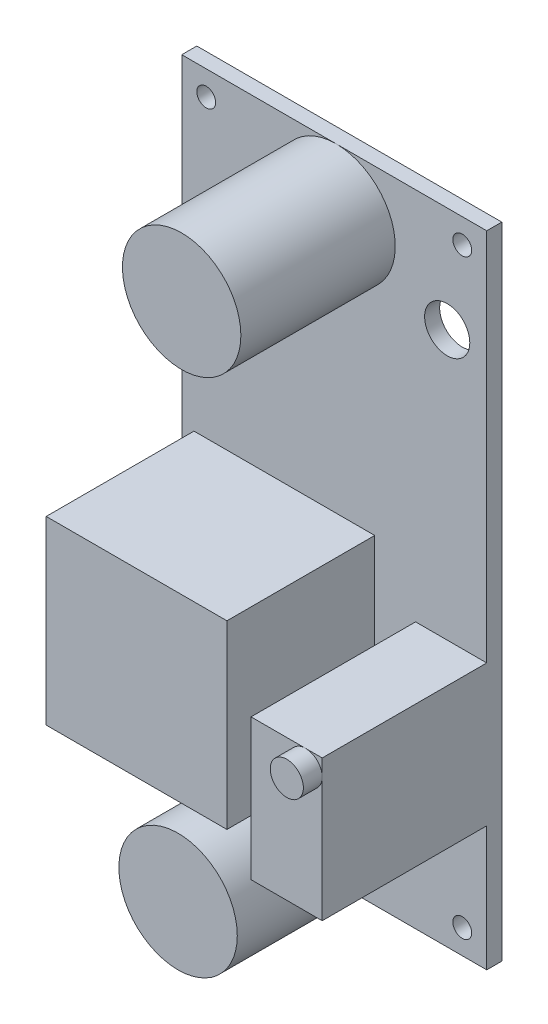
from build123d import *

# Parameters (mm, degrees)
SKETCH1_W           = 20.574
SKETCH1_H           = 43.18
BOSS_EXTRUDE1_DEPTH = 1.016
SKETCH2_R           = 1.524
CUT_EXTRUDE1_DEPTH  = 48.841761381
SKETCH3_R           = 0.635
CUT_EXTRUDE2_DEPTH  = 2.54
SKETCH4_W           = 0.79375
SKETCH4_H           = 0.071233975
SKETCH4_W_2         = 0.081410257
SKETCH4_H_2         = 0.305288462
SKETCH4_H_3         = 0.071233974
BOSS_EXTRUDE2_DEPTH = 0.00254
SKETCH5_W           = 12.192
SKETCH5_H           = 12.192
BOSS_EXTRUDE3_DEPTH = 9.9695
SKETCH6_R           = 3.99415
BOSS_EXTRUDE4_DEPTH = 10.414
SKETCH7_W           = 4.8006
SKETCH7_H           = 9.5123
BOSS_EXTRUDE5_DEPTH = 11.0998
SKETCH8_R           = 1.1176
BOSS_EXTRUDE6_DEPTH = 1.27


with BuildPart() as part:
    # Sketch1 → Boss-Extrude1 (new body)
    with BuildSketch(Plane.XY):
        with Locations((10.287, 21.59)):
            Rectangle(SKETCH1_W, SKETCH1_H)
    extrude(amount=BOSS_EXTRUDE1_DEPTH)

    # Sketch2 → Cut-Extrude1 (cut, through all)
    with BuildSketch(Plane.XY.offset(1.016)):
        with Locations((17.907, 36.068)):
            Circle(SKETCH2_R)
        with Locations((3.0988, 6.35)):
            Circle(SKETCH2_R)
    extrude(amount=-CUT_EXTRUDE1_DEPTH, mode=Mode.SUBTRACT)

    # Sketch3 → Cut-Extrude2 (cut)
    with BuildSketch(Plane.XY.offset(1.016)):
        with Locations((18.923, 41.529)):
            Circle(SKETCH3_R)
        with Locations((18.923, 1.651)):
            Circle(SKETCH3_R)
        with Locations((1.651, 1.651)):
            Circle(SKETCH3_R)
        with Locations((1.651, 41.529)):
            Circle(SKETCH3_R)
    extrude(amount=-CUT_EXTRUDE2_DEPTH, mode=Mode.SUBTRACT)

    # Sketch4 → Boss-Extrude2 (add)
    # profile 1 of 14: a face of its own
    with BuildSketch(Plane(origin=(0, 0, 0), x_dir=(-1, 0, 0), z_dir=(0, 0, -1))):
        Polygon((-17.848673525, 42.286725962), (-18.082728012, 42.286725962), (-18.082728012, 42.357959936), (-17.848673525, 42.357959936), (-17.848673525, 42.592014423), (-17.777439551, 42.592014423), (-17.777439551, 42.357959936), (-17.543385063, 42.357959936), (-17.543385063, 42.286725962), (-17.777439551, 42.286725962), (-17.777439551, 42.052671474), (-17.848673525, 42.052671474), align=None)
    # profile 2 of 14: a face of its own
    with BuildSketch(Plane(origin=(0, 0, 0), x_dir=(-1, 0, 0), z_dir=(0, 0, -1))):
        Polygon((-17.421269679, 41.279274038), (-18.215019679, 41.279274038), (-18.215019679, 41.294220453), (-17.590291363, 41.818616987), (-18.215019679, 41.818616987), (-18.215019679, 41.889850962), (-17.421269679, 41.889850962), (-17.421269679, 41.873632512), (-18.044566954, 41.350508013), (-17.421269679, 41.350508013), align=None)
    # profile 3 of 14: a face of its own
    with BuildSketch(Plane(origin=(0, 0, 0), x_dir=(-1, 0, 0), z_dir=(0, 0, -1))):
        with Locations((-17.818144679, 41.070660257)):
            Rectangle(SKETCH4_W, SKETCH4_H)
    # profile 4 of 14: a face of its own
    with BuildSketch(Plane(origin=(0, 0, 0), x_dir=(-1, 0, 0), z_dir=(0, 0, -1))):
        with Locations((-2.746900665, 42.32743109)):
            Rectangle(SKETCH4_W_2, SKETCH4_H_2)
    # profile 5 of 14: a face of its own
    with BuildSketch(Plane(origin=(0, 0, 0), x_dir=(-1, 0, 0), z_dir=(0, 0, -1))):
        Polygon((-2.441612203, 41.431918269), (-3.235362203, 41.431918269), (-3.235362203, 41.446864683), (-2.610633888, 41.971261218), (-3.235362203, 41.971261218), (-3.235362203, 42.042495192), (-2.441612203, 42.042495192), (-2.441612203, 42.026276743), (-3.064909479, 41.503152244), (-2.441612203, 41.503152244), align=None)
    # profile 6 of 14: a face of its own
    with BuildSketch(Plane(origin=(0, 0, 0), x_dir=(-1, 0, 0), z_dir=(0, 0, -1))):
        with Locations((-2.838487203, 41.223304487)):
            Rectangle(SKETCH4_W, SKETCH4_H_3)
    # profile 7 of 14: a face of its own
    with BuildSketch(Plane(origin=(0, 0, 0), x_dir=(-1, 0, 0), z_dir=(0, 0, -1))):
        with BuildLine():
            add(Edge.make_bspline(
                [(-18.235372243, 1.075856171), (-18.235006246, 1.090555326), (-18.234287397, 1.11942568), (-18.228603062, 1.161816811), (-18.21924724, 1.202408219), (-18.206034822, 1.241223241), (-18.188906583, 1.278114253), (-18.168100678, 1.313185445), (-18.143490664, 1.346331712), (-18.115437918, 1.377324896), (-18.084715583, 1.405597859), (-18.05182674, 1.430407531), (-18.017184889, 1.451336831), (-17.980788224, 1.468469742), (-17.94272172, 1.481920213), (-17.902772035, 1.491199415), (-17.861200825, 1.497127353), (-17.832846501, 1.497820335), (-17.818462688, 1.498171876)],
                knots=[0, 0, 0, 0, 1.065064174, 2.09187391, 3.093564831, 4.079973196, 5.057907931, 6.036227367, 7.030399151, 8.044883615, 9.061699972, 10.052012555, 11.025713132, 11.989727027, 12.962874294, 13.945865945, 14.957962116, 16, 16, 16, 16], degree=3))
            add(Edge.make_bspline(
                [(-17.818462688, 1.498171876), (-17.804184912, 1.497820217), (-17.776041763, 1.497127054), (-17.734733171, 1.491194605), (-17.695028998, 1.481878809), (-17.65701774, 1.468636278), (-17.620694998, 1.451490219), (-17.586026922, 1.430530108), (-17.553050233, 1.405767522), (-17.522116245, 1.37761462), (-17.493818809, 1.346833758), (-17.468859368, 1.314071317), (-17.447920958, 1.27943039), (-17.430596773, 1.24326996), (-17.417426608, 1.205306084), (-17.407838293, 1.165815025), (-17.401969203, 1.124581624), (-17.401271659, 1.096493068), (-17.400917115, 1.082216348)],
                knots=[0, 0, 0, 0, 1.043748596, 2.057349401, 3.045489418, 4.02252776, 4.995289225, 5.97782527, 6.980224157, 8.006516136, 9.032559198, 10.034193337, 11.013412982, 11.987833483, 12.961212594, 13.946489799, 14.956251404, 16, 16, 16, 16], degree=3))
            add(Edge.make_bspline(
                [(-17.400917115, 1.082216348), (-17.401268493, 1.067832618), (-17.401961155, 1.039478458), (-17.407898723, 0.997854881), (-17.417183626, 0.957877607), (-17.43045273, 0.919660959), (-17.447601638, 0.883183627), (-17.468512274, 0.848374269), (-17.493324251, 0.815372605), (-17.521483456, 0.784452245), (-17.552138433, 0.756160909), (-17.584984773, 0.731495836), (-17.619378064, 0.710580498), (-17.655413752, 0.693489171), (-17.692917633, 0.679958124), (-17.732139877, 0.670726852), (-17.772856872, 0.664754235), (-17.800579815, 0.664065975), (-17.814646582, 0.663716748)],
                knots=[0, 0, 0, 0, 1.053102029, 2.075944431, 3.073151272, 4.055350789, 5.033113405, 6.020478099, 7.024410459, 8.052272461, 9.079885166, 10.07527673, 11.055994387, 12.023226415, 12.992069828, 13.970394897, 14.97016774, 16, 16, 16, 16], degree=3))
            add(Edge.make_bspline(
                [(-17.814646582, 0.663716748), (-17.824088276, 0.663837996), (-17.842852554, 0.664078962), (-17.870716944, 0.666979935), (-17.898133218, 0.671189464), (-17.925023415, 0.677222397), (-17.95132171, 0.68511265), (-17.977209472, 0.694422664), (-18.002424353, 0.705793664), (-18.0270858, 0.718648026), (-18.050809379, 0.7329949), (-18.073233856, 0.748841722), (-18.094547403, 0.765631886), (-18.114197706, 0.784038584), (-18.13275641, 0.80345517), (-18.149938312, 0.824196624), (-18.165898346, 0.846136383), (-18.180281173, 0.869368851), (-18.193289405, 0.893321567), (-18.204452218, 0.918013265), (-18.214033021, 0.943108595), (-18.221798351, 0.968725095), (-18.227928831, 0.994794742), (-18.232103356, 1.021374432), (-18.235011728, 1.048442991), (-18.235251554, 1.06667913), (-18.235372243, 1.075856171)],
                knots=[0, 0, 0, 0, 1.037015668, 2.060948919, 3.074880161, 4.083647147, 5.086022904, 6.090072063, 7.104153813, 8.122640571, 9.144368836, 10.147691507, 11.138137339, 12.123020368, 13.103399296, 14.087645067, 15.080126199, 16.082011238, 17.087798457, 18.072939717, 19.057185487, 20.037253025, 21.01195951, 21.997135196, 22.992090687, 24, 24, 24, 24], degree=3))
        make_face()
        with BuildLine():
            add(Edge.make_bspline(
                [(-18.153961986, 1.079354268), (-18.153870483, 1.071821568), (-18.153688352, 1.056828179), (-18.151276124, 1.034540075), (-18.14786271, 1.012538327), (-18.142905235, 0.990865513), (-18.136492957, 0.96947618), (-18.128759243, 0.948360832), (-18.119411891, 0.927591868), (-18.108899658, 0.907195232), (-18.096959443, 0.887642022), (-18.0842801, 0.868885146), (-18.070390525, 0.851412487), (-18.055591099, 0.83498402), (-18.039753387, 0.819640601), (-18.022981396, 0.805388997), (-18.005202585, 0.792240895), (-17.986490119, 0.780354528), (-17.966948474, 0.769776589), (-17.946951204, 0.760305717), (-17.926263297, 0.752454725), (-17.905013853, 0.746235569), (-17.883296514, 0.740956932), (-17.860992955, 0.737645779), (-17.838180065, 0.735209784), (-17.822762664, 0.735037741), (-17.814964591, 0.734950723)],
                knots=[0, 0, 0, 0, 1.008406545, 2.007172654, 2.999155034, 3.989332444, 4.982025741, 5.988181096, 6.998684226, 8.030553839, 9.059268815, 10.065399129, 11.060956322, 12.046057109, 13.024974577, 14.012068307, 14.991706172, 15.984221787, 16.978487447, 17.966117052, 18.945677757, 19.938371053, 20.93015022, 21.936155317, 22.956113857, 24, 24, 24, 24], degree=3))
            add(Edge.make_bspline(
                [(-17.814964591, 0.734950723), (-17.803498062, 0.735240505), (-17.780939853, 0.735810595), (-17.747878001, 0.740780821), (-17.716073226, 0.748497586), (-17.685715099, 0.759685439), (-17.656668243, 0.773957752), (-17.629045699, 0.791367078), (-17.602855614, 0.812072847), (-17.578292949, 0.835578949), (-17.555882556, 0.861282251), (-17.536183703, 0.888562295), (-17.519604599, 0.917203249), (-17.505744841, 0.947040035), (-17.495303475, 0.978327394), (-17.487858787, 1.010864724), (-17.483033673, 1.044652744), (-17.482565039, 1.067677321), (-17.482327371, 1.079354268)],
                knots=[0, 0, 0, 0, 1.032022337, 2.030307203, 3.003823408, 3.974715386, 4.937372378, 5.913284036, 6.909147208, 7.938749767, 8.970518239, 9.975863271, 10.963918693, 11.946286286, 12.933361397, 13.927862637, 14.949112547, 16, 16, 16, 16], degree=3))
            add(Edge.make_bspline(
                [(-17.482327371, 1.079354268), (-17.482435122, 1.08720324), (-17.482648823, 1.102770107), (-17.484804263, 1.125923461), (-17.488253848, 1.148661836), (-17.493245074, 1.170943221), (-17.499409188, 1.192796808), (-17.507055136, 1.214156657), (-17.516220796, 1.235015675), (-17.526435619, 1.255476429), (-17.538039384, 1.275080784), (-17.550547797, 1.293723885), (-17.564192296, 1.311166441), (-17.57879296, 1.3275872), (-17.594581987, 1.342823088), (-17.611252048, 1.357034115), (-17.629068593, 1.369954882), (-17.647704417, 1.381800954), (-17.667103591, 1.39250796), (-17.687155839, 1.401704885), (-17.707753613, 1.409559249), (-17.728912047, 1.415890756), (-17.750583548, 1.420854682), (-17.772799132, 1.424274425), (-17.795513815, 1.426666705), (-17.810877157, 1.426847011), (-17.818621692, 1.426937902)],
                knots=[0, 0, 0, 0, 1.047334373, 2.07717862, 3.100662057, 4.115010574, 5.122652213, 6.129548646, 7.140165612, 8.16200981, 9.179904151, 10.178566626, 11.156366481, 12.133321541, 13.108841334, 14.082538371, 15.054589433, 16.043660176, 17.028268541, 18.009491307, 18.985652105, 19.968123554, 20.954864208, 21.950389976, 22.966808393, 24, 24, 24, 24], degree=3))
            add(Edge.make_bspline(
                [(-17.818621692, 1.426937902), (-17.826313244, 1.426846935), (-17.841570854, 1.426666486), (-17.864127147, 1.424275604), (-17.886182786, 1.420850937), (-17.907651184, 1.415915466), (-17.928537814, 1.409554092), (-17.948823057, 1.401710179), (-17.968582492, 1.392460659), (-17.987767252, 1.38184521), (-18.00617659, 1.369912738), (-18.023775461, 1.356873697), (-18.040234844, 1.34250397), (-18.055955513, 1.327210359), (-18.07062302, 1.310625173), (-18.084180694, 1.292745516), (-18.097239397, 1.27401657), (-18.108796494, 1.254014793), (-18.119522891, 1.233446289), (-18.128674153, 1.212321281), (-18.136533791, 1.190941465), (-18.142924377, 1.169221362), (-18.14784372, 1.147171237), (-18.151279179, 1.124803914), (-18.153687524, 1.102197468), (-18.153870208, 1.086992831), (-18.153961986, 1.079354268)],
                knots=[0, 0, 0, 0, 1.029877221, 2.042951179, 3.035109885, 4.018542222, 4.991021277, 5.957494829, 6.929429462, 7.911425532, 8.892163142, 9.866273635, 10.842761649, 11.81676864, 12.802607151, 13.805177466, 14.821356543, 15.858816981, 16.897175917, 17.927346774, 18.940346092, 19.946830556, 20.957962087, 21.964146003, 22.97721996, 24, 24, 24, 24], degree=3))
        make_face(mode=Mode.SUBTRACT)
    # profile 8 of 14: a face of its own
    with BuildSketch(Plane(origin=(0, 0, 0), x_dir=(-1, 0, 0), z_dir=(0, 0, -1))):
        with BuildLine():
            Line((-18.215019679, 1.660992389), (-18.215019679, 1.732226364))
            Line((-18.215019679, 1.732226364), (-17.739437497, 1.732226364))
            add(Edge.make_bspline(
                [(-17.739437497, 1.732226364), (-17.73270633, 1.732215763), (-17.719932781, 1.732195646), (-17.701751756, 1.73233002), (-17.685588181, 1.732706341), (-17.67137975, 1.732943595), (-17.659191663, 1.733471401), (-17.648957887, 1.733901851), (-17.64072688, 1.734455334), (-17.635923349, 1.735120523), (-17.633858571, 1.735406452)],
                knots=[0, 0, 0, 0, 1.528628734, 2.90083645, 4.128790002, 5.200304208, 6.127813768, 6.898992206, 7.526736466, 8, 8, 8, 8], degree=3))
            add(Edge.make_bspline(
                [(-17.633858571, 1.735406452), (-17.62635228, 1.736567251), (-17.611861722, 1.738808121), (-17.59124176, 1.744761694), (-17.572623805, 1.752698767), (-17.555587904, 1.76254518), (-17.54024232, 1.774986165), (-17.526469275, 1.790432033), (-17.513953078, 1.808605859), (-17.503040753, 1.829247266), (-17.493977148, 1.851240722), (-17.487195246, 1.87379776), (-17.483044725, 1.896483032), (-17.482565397, 1.911672669), (-17.482327371, 1.919215546)],
                knots=[0, 0, 0, 0, 1.042777144, 2.01303441, 2.939567723, 3.817555404, 4.708046775, 5.641195415, 6.651191522, 7.732783915, 8.843021186, 9.914367358, 10.964315445, 12, 12, 12, 12], degree=3))
            add(Edge.make_bspline(
                [(-17.482327371, 1.919215546), (-17.482569555, 1.925691696), (-17.483052524, 1.938606591), (-17.486080133, 1.957785642), (-17.491429047, 1.976523967), (-17.498715245, 1.994674361), (-17.507675315, 2.011941849), (-17.518409332, 2.027883715), (-17.530912384, 2.042170214), (-17.544769217, 2.055207442), (-17.560384265, 2.066493473), (-17.577380814, 2.076472089), (-17.596212068, 2.084396945), (-17.609438251, 2.088409275), (-17.616209082, 2.090463293)],
                knots=[0, 0, 0, 0, 0.994718802, 1.98369237, 2.973235266, 3.981451368, 4.982709966, 5.955777334, 6.925228988, 7.892833478, 8.871333226, 9.877970804, 10.913677552, 12, 12, 12, 12], degree=3))
            add(Edge.make_bspline(
                [(-17.616209082, 2.090463293), (-17.619009562, 2.091143678), (-17.625250161, 2.092659852), (-17.635800525, 2.094076592), (-17.648248648, 2.095552179), (-17.66268397, 2.096576019), (-17.679058119, 2.097574153), (-17.697456396, 2.098171296), (-17.717811992, 2.098447302), (-17.732017206, 2.098529553), (-17.739437497, 2.098572518)],
                knots=[0, 0, 0, 0, 0.558680831, 1.244966039, 2.062412453, 2.990489873, 4.051219941, 5.244515665, 6.560634259, 8, 8, 8, 8], degree=3))
            Line((-17.739437497, 2.098572518), (-18.215019679, 2.098572518))
            Line((-18.215019679, 2.098572518), (-18.215019679, 2.169806492))
            Line((-18.215019679, 2.169806492), (-17.735621392, 2.169806492))
            add(Edge.make_bspline(
                [(-17.735621392, 2.169806492), (-17.726981225, 2.169748853), (-17.710119415, 2.169636367), (-17.68541078, 2.168661171), (-17.661971884, 2.167105699), (-17.639799097, 2.164909962), (-17.618973411, 2.161993969), (-17.599357652, 2.15878121), (-17.581059969, 2.154618267), (-17.563869254, 2.149791786), (-17.547422608, 2.144353002), (-17.531844499, 2.137185029), (-17.516677396, 2.129144183), (-17.50209113, 2.119684551), (-17.488178375, 2.108801656), (-17.474578981, 2.096912435), (-17.461698248, 2.083597827), (-17.449377313, 2.069251103), (-17.43791884, 2.053968725), (-17.427947371, 2.037652013), (-17.419827892, 2.020391052), (-17.412621693, 2.002594567), (-17.407499711, 1.983835879), (-17.403605234, 1.964348652), (-17.401410977, 1.944017298), (-17.401083131, 1.930191724), (-17.400917115, 1.923190657)],
                knots=[0, 0, 0, 0, 1.316707045, 2.569633854, 3.76780728, 4.896239288, 5.964314126, 6.972204208, 7.924543903, 8.822147865, 9.693191779, 10.560896119, 11.431827672, 12.307838457, 13.206132673, 14.12176355, 15.058527151, 16.026630406, 17.00238624, 17.966538933, 18.934743273, 19.906713913, 20.888635248, 21.892958714, 22.933025263, 24, 24, 24, 24], degree=3))
            add(Edge.make_bspline(
                [(-17.400917115, 1.923190657), (-17.401094965, 1.915554929), (-17.401443906, 1.90057366), (-17.403446527, 1.878499567), (-17.407208976, 1.857334361), (-17.412030737, 1.836871477), (-17.418572259, 1.817308609), (-17.426610044, 1.798651521), (-17.435786396, 1.780685991), (-17.446629704, 1.763816778), (-17.458453601, 1.7479055), (-17.471440856, 1.733445785), (-17.485096846, 1.720070574), (-17.49993579, 1.708369416), (-17.51565392, 1.697899734), (-17.532325166, 1.688892233), (-17.549927179, 1.681155104), (-17.562163091, 1.677162285), (-17.568348755, 1.675143782)],
                knots=[0, 0, 0, 0, 1.138939089, 2.234594419, 3.301501784, 4.342532435, 5.367382236, 6.373123747, 7.370098489, 8.372230273, 9.360297234, 10.323289009, 11.268038109, 12.20748145, 13.137029304, 14.081414587, 15.030090602, 16, 16, 16, 16], degree=3))
            add(Edge.make_bspline(
                [(-17.568348755, 1.675143782), (-17.572574357, 1.673969676), (-17.581739781, 1.671423015), (-17.596908681, 1.668695849), (-17.614374564, 1.666403254), (-17.634138626, 1.664247529), (-17.656216185, 1.662975498), (-17.680597671, 1.661860293), (-17.707312566, 1.660984533), (-17.725921358, 1.660989697), (-17.735621392, 1.660992389)],
                knots=[0, 0, 0, 0, 0.625038921, 1.35572334, 2.194682327, 3.136881307, 4.189498639, 5.346923369, 6.617055217, 8, 8, 8, 8], degree=3))
            Line((-17.735621392, 1.660992389), (-18.215019679, 1.660992389))
        make_face()
    # profile 9 of 14: a face of its own
    with BuildSketch(Plane(origin=(0, 0, 0), x_dir=(-1, 0, 0), z_dir=(0, 0, -1))):
        Polygon((-18.133609422, 2.291921876), (-18.215019679, 2.291921876), (-18.215019679, 2.709149441), (-18.133609422, 2.709149441), (-18.133609422, 2.536152646), (-17.421269679, 2.536152646), (-17.421269679, 2.464918671), (-18.133609422, 2.464918671), align=None)
    # profile 10 of 14: a face of its own
    with BuildSketch(Plane(origin=(0, 0, 0), x_dir=(-1, 0, 0), z_dir=(0, 0, -1))):
        Polygon((-17.848673525, 3.044966748), (-18.082728012, 3.044966748), (-18.082728012, 3.116200723), (-17.848673525, 3.116200723), (-17.848673525, 3.35025521), (-17.777439551, 3.35025521), (-17.777439551, 3.116200723), (-17.543385063, 3.116200723), (-17.543385063, 3.044966748), (-17.777439551, 3.044966748), (-17.777439551, 2.810912261), (-17.848673525, 2.810912261), align=None)
    # profile 11 of 14: a face of its own
    with BuildSketch(Plane(origin=(0, 0, 0), x_dir=(-1, 0, 0), z_dir=(0, 0, -1))):
        with BuildLine():
            add(Edge.make_bspline(
                [(-3.255714767, 1.228500356), (-3.25534877, 1.243199511), (-3.254629921, 1.272069864), (-3.248945586, 1.314460995), (-3.239589764, 1.355052404), (-3.226377347, 1.393867425), (-3.209249107, 1.430758437), (-3.188443202, 1.465829629), (-3.163833189, 1.498975897), (-3.135780442, 1.52996908), (-3.105058107, 1.558242044), (-3.072169264, 1.583051716), (-3.037527413, 1.603981015), (-3.001130748, 1.621113927), (-2.963064244, 1.634564398), (-2.923114559, 1.6438436), (-2.88154335, 1.649771537), (-2.853189025, 1.650464519), (-2.838805212, 1.650816061)],
                knots=[0, 0, 0, 0, 1.065064174, 2.09187391, 3.093564831, 4.079973196, 5.057907931, 6.036227367, 7.030399151, 8.044883615, 9.061699972, 10.052012555, 11.025713132, 11.989727027, 12.962874294, 13.945865945, 14.957962116, 16, 16, 16, 16], degree=3))
            add(Edge.make_bspline(
                [(-2.838805212, 1.650816061), (-2.824527436, 1.650464401), (-2.796384287, 1.649771238), (-2.755075695, 1.64383879), (-2.715371522, 1.634522994), (-2.677360264, 1.621280462), (-2.641037522, 1.604134404), (-2.606369446, 1.583174293), (-2.573392757, 1.558411706), (-2.54245877, 1.530258805), (-2.514161333, 1.499477943), (-2.489201892, 1.466715501), (-2.468263482, 1.432074574), (-2.450939297, 1.395914144), (-2.437769132, 1.357950268), (-2.428180817, 1.31845921), (-2.422311727, 1.277225808), (-2.421614183, 1.249137252), (-2.421259639, 1.234860532)],
                knots=[0, 0, 0, 0, 1.043748596, 2.057349401, 3.045489418, 4.02252776, 4.995289225, 5.97782527, 6.980224157, 8.006516136, 9.032559198, 10.034193337, 11.013412982, 11.987833483, 12.961212594, 13.946489799, 14.956251404, 16, 16, 16, 16], degree=3))
            add(Edge.make_bspline(
                [(-2.421259639, 1.234860532), (-2.421611018, 1.220476803), (-2.422303679, 1.192122643), (-2.428241248, 1.150499065), (-2.43752615, 1.110521791), (-2.450795255, 1.072305144), (-2.467944162, 1.035827811), (-2.488854798, 1.001018453), (-2.513666775, 0.96801679), (-2.54182598, 0.937096429), (-2.572480957, 0.908805093), (-2.605327297, 0.884140021), (-2.639720588, 0.863224682), (-2.675756277, 0.846133355), (-2.713260158, 0.832602308), (-2.752482402, 0.823371037), (-2.793199397, 0.817398419), (-2.82092234, 0.816710159), (-2.834989106, 0.816360933)],
                knots=[0, 0, 0, 0, 1.053102029, 2.075944431, 3.073151272, 4.055350789, 5.033113405, 6.020478099, 7.024410459, 8.052272461, 9.079885166, 10.07527673, 11.055994387, 12.023226415, 12.992069828, 13.970394897, 14.97016774, 16, 16, 16, 16], degree=3))
            add(Edge.make_bspline(
                [(-2.834989106, 0.816360933), (-2.844430801, 0.81648218), (-2.863195079, 0.816723146), (-2.891059468, 0.819624119), (-2.918475743, 0.823833648), (-2.94536594, 0.829866582), (-2.971664234, 0.837756835), (-2.997551997, 0.847066848), (-3.022766877, 0.858437849), (-3.047428325, 0.87129221), (-3.071151903, 0.885639084), (-3.09357638, 0.901485906), (-3.114889928, 0.91827607), (-3.13454023, 0.936682768), (-3.153098935, 0.956099355), (-3.170280836, 0.976840808), (-3.18624087, 0.998780567), (-3.200623697, 1.022013036), (-3.21363193, 1.045965752), (-3.224794742, 1.070657449), (-3.234375546, 1.095752779), (-3.242140876, 1.12136928), (-3.248271355, 1.147438926), (-3.25244588, 1.174018617), (-3.255354252, 1.201087176), (-3.255594078, 1.219323314), (-3.255714767, 1.228500356)],
                knots=[0, 0, 0, 0, 1.037015668, 2.060948919, 3.074880161, 4.083647147, 5.086022904, 6.090072063, 7.104153813, 8.122640571, 9.144368836, 10.147691507, 11.138137339, 12.123020368, 13.103399296, 14.087645067, 15.080126199, 16.082011238, 17.087798457, 18.072939717, 19.057185487, 20.037253025, 21.01195951, 21.997135196, 22.992090687, 24, 24, 24, 24], degree=3))
        make_face()
        with BuildLine():
            add(Edge.make_bspline(
                [(-3.174304511, 1.231998453), (-3.174213008, 1.224465752), (-3.174030876, 1.209472364), (-3.171618649, 1.187184259), (-3.168205234, 1.165182512), (-3.163247759, 1.143509697), (-3.156835481, 1.122120364), (-3.149101767, 1.101005017), (-3.139754415, 1.080236052), (-3.129242182, 1.059839417), (-3.117301967, 1.040286206), (-3.104622625, 1.02152933), (-3.090733049, 1.004056671), (-3.075933623, 0.987628204), (-3.060095911, 0.972284785), (-3.043323921, 0.958033181), (-3.025545109, 0.94488508), (-3.006832643, 0.932998712), (-2.987290999, 0.922420773), (-2.967293728, 0.912949901), (-2.946605821, 0.905098909), (-2.925356377, 0.898879754), (-2.903639038, 0.893601116), (-2.881335479, 0.890289964), (-2.858522589, 0.887853968), (-2.843105188, 0.887681926), (-2.835307115, 0.887594907)],
                knots=[0, 0, 0, 0, 1.008406545, 2.007172654, 2.999155034, 3.989332444, 4.982025741, 5.988181096, 6.998684226, 8.030553839, 9.059268815, 10.065399129, 11.060956322, 12.046057109, 13.024974577, 14.012068307, 14.991706172, 15.984221787, 16.978487447, 17.966117052, 18.945677757, 19.938371053, 20.93015022, 21.936155317, 22.956113857, 24, 24, 24, 24], degree=3))
            add(Edge.make_bspline(
                [(-2.835307115, 0.887594907), (-2.823840586, 0.887884689), (-2.801282377, 0.88845478), (-2.768220525, 0.893425005), (-2.736415751, 0.901141771), (-2.706057623, 0.912329623), (-2.677010767, 0.926601937), (-2.649388223, 0.944011262), (-2.623198139, 0.964717031), (-2.598635473, 0.988223133), (-2.576225081, 1.013926436), (-2.556526228, 1.041206479), (-2.539947124, 1.069847433), (-2.526087365, 1.099684219), (-2.515646, 1.130971578), (-2.508201311, 1.163508908), (-2.503376197, 1.197296928), (-2.502907563, 1.220321505), (-2.502669895, 1.231998453)],
                knots=[0, 0, 0, 0, 1.032022337, 2.030307203, 3.003823408, 3.974715386, 4.937372378, 5.913284036, 6.909147208, 7.938749767, 8.970518239, 9.975863271, 10.963918693, 11.946286286, 12.933361397, 13.927862637, 14.949112547, 16, 16, 16, 16], degree=3))
            add(Edge.make_bspline(
                [(-2.502669895, 1.231998453), (-2.502777646, 1.239847424), (-2.502991348, 1.255414292), (-2.505146787, 1.278567645), (-2.508596373, 1.30130602), (-2.513587598, 1.323587405), (-2.519751712, 1.345440992), (-2.527397661, 1.366800842), (-2.53656332, 1.387659859), (-2.546778144, 1.408120614), (-2.558381908, 1.427724969), (-2.570890322, 1.446368069), (-2.584534821, 1.463810625), (-2.599135484, 1.480231384), (-2.614924511, 1.495467272), (-2.631594572, 1.509678299), (-2.649411117, 1.522599066), (-2.668046941, 1.534445138), (-2.687446115, 1.545152145), (-2.707498363, 1.554349069), (-2.728096137, 1.562203433), (-2.749254572, 1.568534941), (-2.770926072, 1.573498866), (-2.793141656, 1.576918609), (-2.815856339, 1.57931089), (-2.831219681, 1.579491196), (-2.838964216, 1.579582087)],
                knots=[0, 0, 0, 0, 1.047334373, 2.07717862, 3.100662057, 4.115010574, 5.122652213, 6.129548646, 7.140165612, 8.16200981, 9.179904151, 10.178566626, 11.156366481, 12.133321541, 13.108841334, 14.082538371, 15.054589433, 16.043660176, 17.028268541, 18.009491307, 18.985652105, 19.968123554, 20.954864208, 21.950389976, 22.966808393, 24, 24, 24, 24], degree=3))
            add(Edge.make_bspline(
                [(-2.838964216, 1.579582087), (-2.846655768, 1.57949112), (-2.861913378, 1.579310671), (-2.884469671, 1.576919788), (-2.90652531, 1.573495122), (-2.927993708, 1.56855965), (-2.948880338, 1.562198277), (-2.969165581, 1.554354363), (-2.988925016, 1.545104843), (-3.008109776, 1.534489394), (-3.026519114, 1.522556923), (-3.044117985, 1.509517881), (-3.060577369, 1.495148154), (-3.076298037, 1.479854543), (-3.090965544, 1.463269357), (-3.104523218, 1.445389701), (-3.117581921, 1.426660755), (-3.129139018, 1.406658978), (-3.139865415, 1.386090473), (-3.149016677, 1.364965465), (-3.156876316, 1.343585649), (-3.163266901, 1.321865546), (-3.168186245, 1.299815421), (-3.171621703, 1.277448099), (-3.174030048, 1.254841652), (-3.174212733, 1.239637016), (-3.174304511, 1.231998453)],
                knots=[0, 0, 0, 0, 1.029877221, 2.042951179, 3.035109885, 4.018542222, 4.991021277, 5.957494829, 6.929429462, 7.911425532, 8.892163142, 9.866273635, 10.842761649, 11.81676864, 12.802607151, 13.805177466, 14.821356543, 15.858816981, 16.897175917, 17.927346774, 18.940346092, 19.946830556, 20.957962087, 21.964146003, 22.97721996, 24, 24, 24, 24], degree=3))
        make_face(mode=Mode.SUBTRACT)
    # profile 12 of 14: a face of its own
    with BuildSketch(Plane(origin=(0, 0, 0), x_dir=(-1, 0, 0), z_dir=(0, 0, -1))):
        with BuildLine():
            Line((-3.235362203, 1.813636574), (-3.235362203, 1.884870548))
            Line((-3.235362203, 1.884870548), (-2.759780022, 1.884870548))
            add(Edge.make_bspline(
                [(-2.759780022, 1.884870548), (-2.753048855, 1.884859947), (-2.740275306, 1.88483983), (-2.72209428, 1.884974204), (-2.705930705, 1.885350525), (-2.691722274, 1.885587779), (-2.679534187, 1.886115585), (-2.669300411, 1.886546035), (-2.661069404, 1.887099518), (-2.656265873, 1.887764707), (-2.654201095, 1.888050636)],
                knots=[0, 0, 0, 0, 1.528628734, 2.90083645, 4.128790002, 5.200304208, 6.127813768, 6.898992206, 7.526736466, 8, 8, 8, 8], degree=3))
            add(Edge.make_bspline(
                [(-2.654201095, 1.888050636), (-2.646694804, 1.889211435), (-2.632204247, 1.891452305), (-2.611584284, 1.897405879), (-2.592966329, 1.905342951), (-2.575930428, 1.915189364), (-2.560584844, 1.927630349), (-2.546811799, 1.943076217), (-2.534295602, 1.961250043), (-2.523383278, 1.98189145), (-2.514319673, 2.003884906), (-2.50753777, 2.026441945), (-2.50338725, 2.049127216), (-2.502907921, 2.064316853), (-2.502669895, 2.071859731)],
                knots=[0, 0, 0, 0, 1.042777144, 2.01303441, 2.939567723, 3.817555404, 4.708046775, 5.641195415, 6.651191522, 7.732783915, 8.843021186, 9.914367358, 10.964315445, 12, 12, 12, 12], degree=3))
            add(Edge.make_bspline(
                [(-2.502669895, 2.071859731), (-2.502912079, 2.07833588), (-2.503395048, 2.091250775), (-2.506422657, 2.110429826), (-2.511771571, 2.129168152), (-2.519057769, 2.147318546), (-2.528017839, 2.164586034), (-2.538751857, 2.180527899), (-2.551254909, 2.194814399), (-2.565111741, 2.207851626), (-2.580726789, 2.219137657), (-2.597723338, 2.229116274), (-2.616554592, 2.237041129), (-2.629780776, 2.24105346), (-2.636551606, 2.243107477)],
                knots=[0, 0, 0, 0, 0.994718802, 1.98369237, 2.973235266, 3.981451368, 4.982709966, 5.955777334, 6.925228988, 7.892833478, 8.871333226, 9.877970804, 10.913677552, 12, 12, 12, 12], degree=3))
            add(Edge.make_bspline(
                [(-2.636551606, 2.243107477), (-2.639352086, 2.243787863), (-2.645592685, 2.245304036), (-2.656143049, 2.246720776), (-2.668591173, 2.248196364), (-2.683026494, 2.249220203), (-2.699400644, 2.250218337), (-2.71779892, 2.250815481), (-2.738154516, 2.251091486), (-2.75235973, 2.251173737), (-2.759780022, 2.251216702)],
                knots=[0, 0, 0, 0, 0.558680831, 1.244966039, 2.062412453, 2.990489873, 4.051219941, 5.244515665, 6.560634259, 8, 8, 8, 8], degree=3))
            Line((-2.759780022, 2.251216702), (-3.235362203, 2.251216702))
            Line((-3.235362203, 2.251216702), (-3.235362203, 2.322450676))
            Line((-3.235362203, 2.322450676), (-2.755963916, 2.322450676))
            add(Edge.make_bspline(
                [(-2.755963916, 2.322450676), (-2.747323749, 2.322393037), (-2.730461939, 2.322280551), (-2.705753304, 2.321305356), (-2.682314408, 2.319749883), (-2.660141621, 2.317554146), (-2.639315936, 2.314638153), (-2.619700177, 2.311425394), (-2.601402493, 2.307262452), (-2.584211778, 2.302435971), (-2.567765132, 2.296997186), (-2.552187023, 2.289829213), (-2.53701992, 2.281788367), (-2.522433655, 2.272328735), (-2.508520899, 2.261445841), (-2.494921506, 2.24955662), (-2.482040773, 2.236242011), (-2.469719837, 2.221895288), (-2.458261364, 2.206612909), (-2.448289895, 2.190296198), (-2.440170416, 2.173035236), (-2.432964218, 2.155238752), (-2.427842235, 2.136480063), (-2.423947758, 2.116992836), (-2.421753501, 2.096661483), (-2.421425655, 2.082835908), (-2.421259639, 2.075834841)],
                knots=[0, 0, 0, 0, 1.316707045, 2.569633854, 3.76780728, 4.896239288, 5.964314126, 6.972204208, 7.924543903, 8.822147865, 9.693191779, 10.560896119, 11.431827672, 12.307838457, 13.206132673, 14.12176355, 15.058527151, 16.026630406, 17.00238624, 17.966538933, 18.934743273, 19.906713913, 20.888635248, 21.892958714, 22.933025263, 24, 24, 24, 24], degree=3))
            add(Edge.make_bspline(
                [(-2.421259639, 2.075834841), (-2.421437489, 2.068199114), (-2.421786431, 2.053217844), (-2.423789051, 2.031143751), (-2.4275515, 2.009978546), (-2.432373262, 1.989515662), (-2.438914783, 1.969952793), (-2.446952568, 1.951295705), (-2.456128921, 1.933330175), (-2.466972228, 1.916460963), (-2.478796126, 1.900549684), (-2.49178338, 1.88608997), (-2.505439371, 1.872714759), (-2.520278314, 1.861013601), (-2.535996444, 1.850543918), (-2.55266769, 1.841536417), (-2.570269703, 1.833799288), (-2.582505615, 1.82980647), (-2.58869128, 1.827787966)],
                knots=[0, 0, 0, 0, 1.138939089, 2.234594419, 3.301501784, 4.342532435, 5.367382236, 6.373123747, 7.370098489, 8.372230273, 9.360297234, 10.323289009, 11.268038109, 12.20748145, 13.137029304, 14.081414587, 15.030090602, 16, 16, 16, 16], degree=3))
            add(Edge.make_bspline(
                [(-2.58869128, 1.827787966), (-2.592916881, 1.82661386), (-2.602082305, 1.824067199), (-2.617251206, 1.821340034), (-2.634717089, 1.819047438), (-2.65448115, 1.816891714), (-2.676558709, 1.815619682), (-2.700940196, 1.814504477), (-2.727655091, 1.813628717), (-2.746263882, 1.813633882), (-2.755963916, 1.813636574)],
                knots=[0, 0, 0, 0, 0.625038921, 1.35572334, 2.194682327, 3.136881307, 4.189498639, 5.346923369, 6.617055217, 8, 8, 8, 8], degree=3))
            Line((-2.755963916, 1.813636574), (-3.235362203, 1.813636574))
        make_face()
    # profile 13 of 14: a face of its own
    with BuildSketch(Plane(origin=(0, 0, 0), x_dir=(-1, 0, 0), z_dir=(0, 0, -1))):
        Polygon((-3.153951947, 2.444566061), (-3.235362203, 2.444566061), (-3.235362203, 2.861793625), (-3.153951947, 2.861793625), (-3.153951947, 2.68879683), (-2.441612203, 2.68879683), (-2.441612203, 2.617562856), (-3.153951947, 2.617562856), align=None)
    # profile 14 of 14: a face of its own
    with BuildSketch(Plane(origin=(0, 0, 0), x_dir=(-1, 0, 0), z_dir=(0, 0, -1))):
        with Locations((-2.746900665, 3.08567183)):
            Rectangle(SKETCH4_W_2, SKETCH4_H_2)
    extrude(amount=BOSS_EXTRUDE2_DEPTH)

    # Sketch5 → Boss-Extrude3 (add)
    with BuildSketch(Plane.XY.offset(1.016)):
        with Locations((6.9215, 15.5067)):
            Rectangle(SKETCH5_W, SKETCH5_H)
    extrude(amount=BOSS_EXTRUDE3_DEPTH)

    # Sketch6 → Boss-Extrude4 (add)
    with BuildSketch(Plane.XY.offset(1.016)):
        with Locations(Location((10.40765, 39.18585, 0), (0, 0, 90))):
            Circle(SKETCH6_R)
        with Locations(Location((10.16635, 3.99415, 0), (0, 0, 270))):
            Circle(SKETCH6_R)
    extrude(amount=BOSS_EXTRUDE4_DEPTH)

    # Sketch7 → Boss-Extrude5 (add)
    with BuildSketch(Plane.XY.offset(1.016)):
        with Locations((18.1737, 13.17625)):
            Rectangle(SKETCH7_W, SKETCH7_H)
    extrude(amount=BOSS_EXTRUDE5_DEPTH)

    # Sketch8 → Boss-Extrude6 (add)
    with BuildSketch(Plane.XY.offset(12.1158)):
        with Locations((19.4564, 16.8148)):
            Circle(SKETCH8_R)
    extrude(amount=BOSS_EXTRUDE6_DEPTH)


solid = part.part
